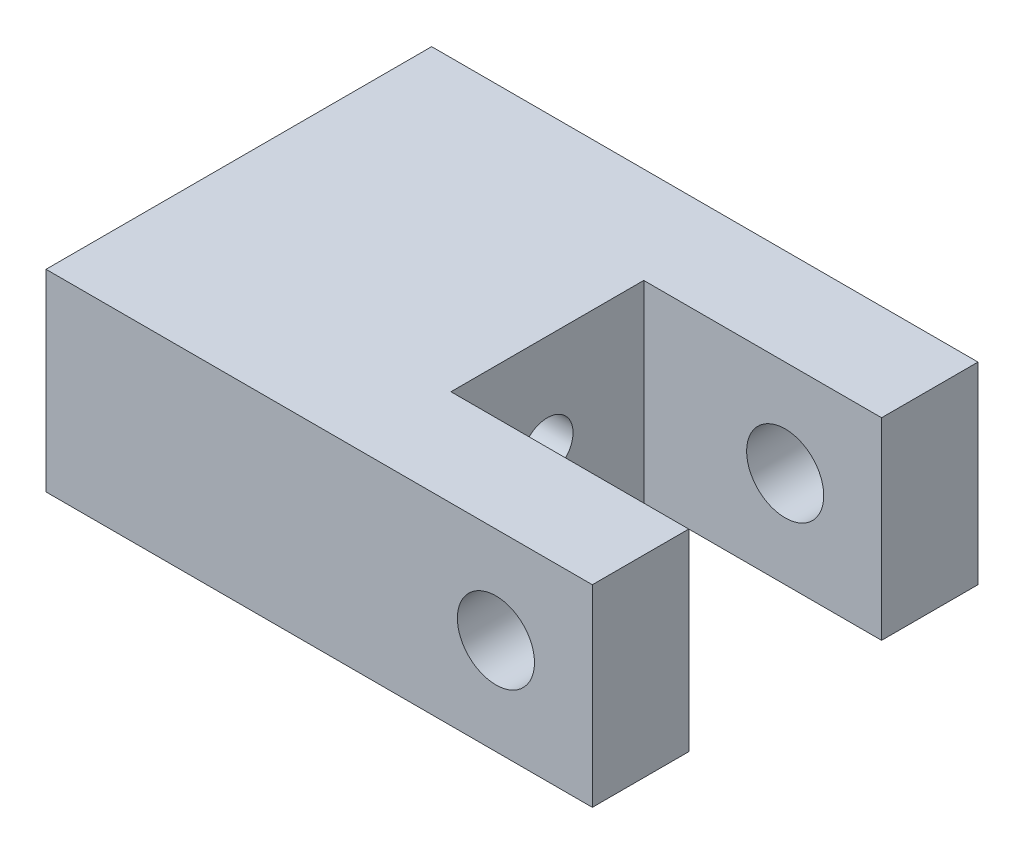
from build123d import *

# Parameters (mm, degrees)
SKETCH1_W                  = 85
SKETCH1_H                  = 60
EXTRUDE1_DEPTH             = 15
F_12_0_12_DIAMETER_HOLE1_D = 12
SKETCH4_W                  = 37
SKETCH4_H                  = 30
CUT_EXTRUDE1_DEPTH         = 82.853527719
F_8_0_8_DIAMETER_HOLE1_D   = 8


with BuildPart() as part:
    # Sketch1 → Extrude1 (new, symmetric)
    with BuildSketch(Plane(origin=(0, 0, 0), x_dir=(1, 0, 0), z_dir=(0, 1, 0))):
        with Locations((-27.5, 0)):
            Rectangle(SKETCH1_W, SKETCH1_H)
    extrude(amount=EXTRUDE1_DEPTH, both=True)

    # Ø12.0 (12) Diameter Hole1 (through all)
    with Locations(Plane.XY.offset(30)):
        with Locations((0, 0)):
            Hole(F_12_0_12_DIAMETER_HOLE1_D / 2)

    # Sketch4 → Cut-Extrude1 (cut, through all)
    with BuildSketch(Plane(origin=(0, 15, 0), x_dir=(1, 0, 0), z_dir=(0, 1, 0))):
        with Locations((-3.5, 0)):
            Rectangle(SKETCH4_W, SKETCH4_H)
    extrude(amount=-CUT_EXTRUDE1_DEPTH, mode=Mode.SUBTRACT)

    # Ø8.0 (8) Diameter Hole1 (through all)
    with Locations(Plane.ZY.offset(70)):
        with Locations((0, 0)):
            Hole(F_8_0_8_DIAMETER_HOLE1_D / 2)

    # Sketch9 → M12x1.75 Tapped Hole1 (revolve, cut)
    with BuildSketch(Plane(origin=(-70, 0, -20), x_dir=(0, 0, 1), z_dir=(0, 1, 0))):
        Polygon((0, 0), (0, 30.314389157), (5.1, 27.25), (5.1, 0), align=None)
    m12x1_75_tapped_hole1 = revolve(axis=Axis((-76.35, 0, -20), (1, 0, 0)), mode=Mode.SUBTRACT)

    # Mirror1: M12x1.75 Tapped Hole1 across plane
    add(m12x1_75_tapped_hole1.mirror(Plane.XY), mode=Mode.SUBTRACT)


solid = part.part
